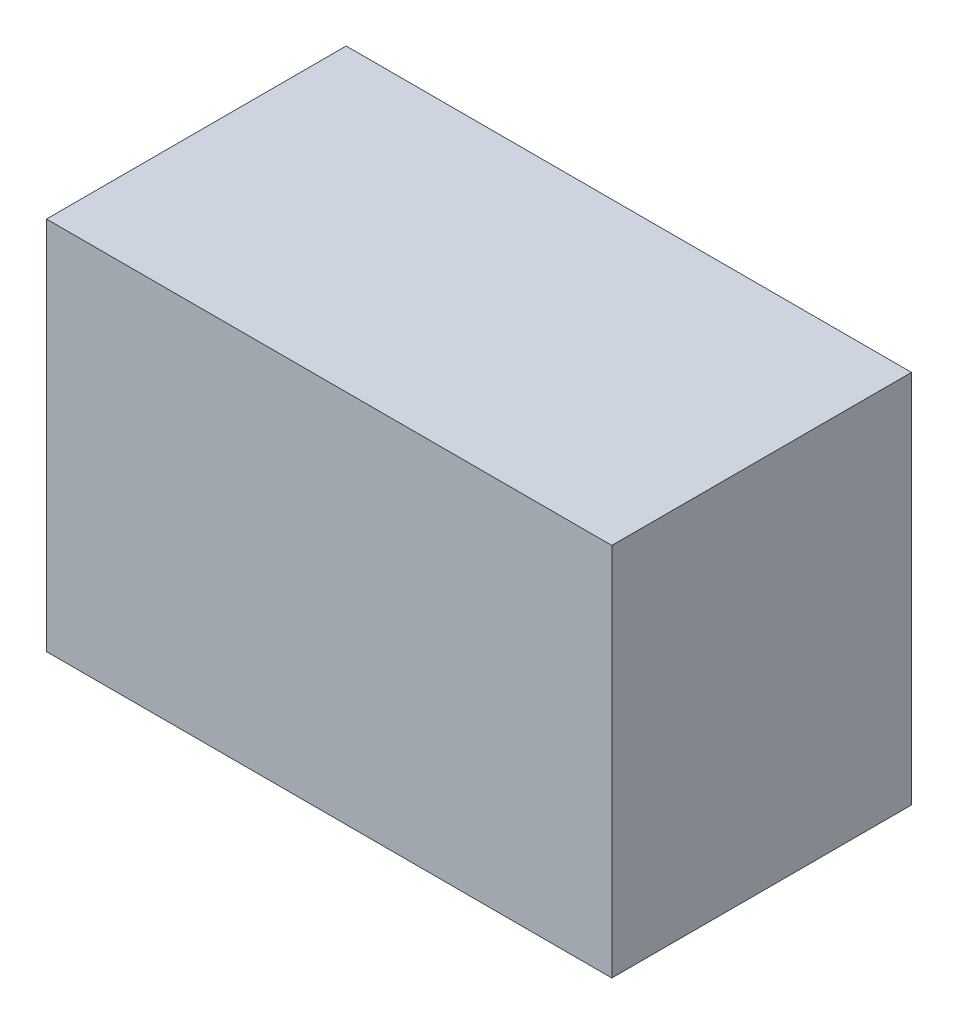
from build123d import *

# Parameters (mm, degrees)
SKETCH1_W           = 332
SKETCH1_H           = 176
BOSS_EXTRUDE1_DEPTH = 220


with BuildPart() as part:
    # Sketch1 → Boss-Extrude1 (new body)
    with BuildSketch(Plane(origin=(0, 0, 0), x_dir=(1, 0, 0), z_dir=(0, 1, 0))):
        Rectangle(SKETCH1_W, SKETCH1_H)
    extrude(amount=BOSS_EXTRUDE1_DEPTH)


solid = part.part
